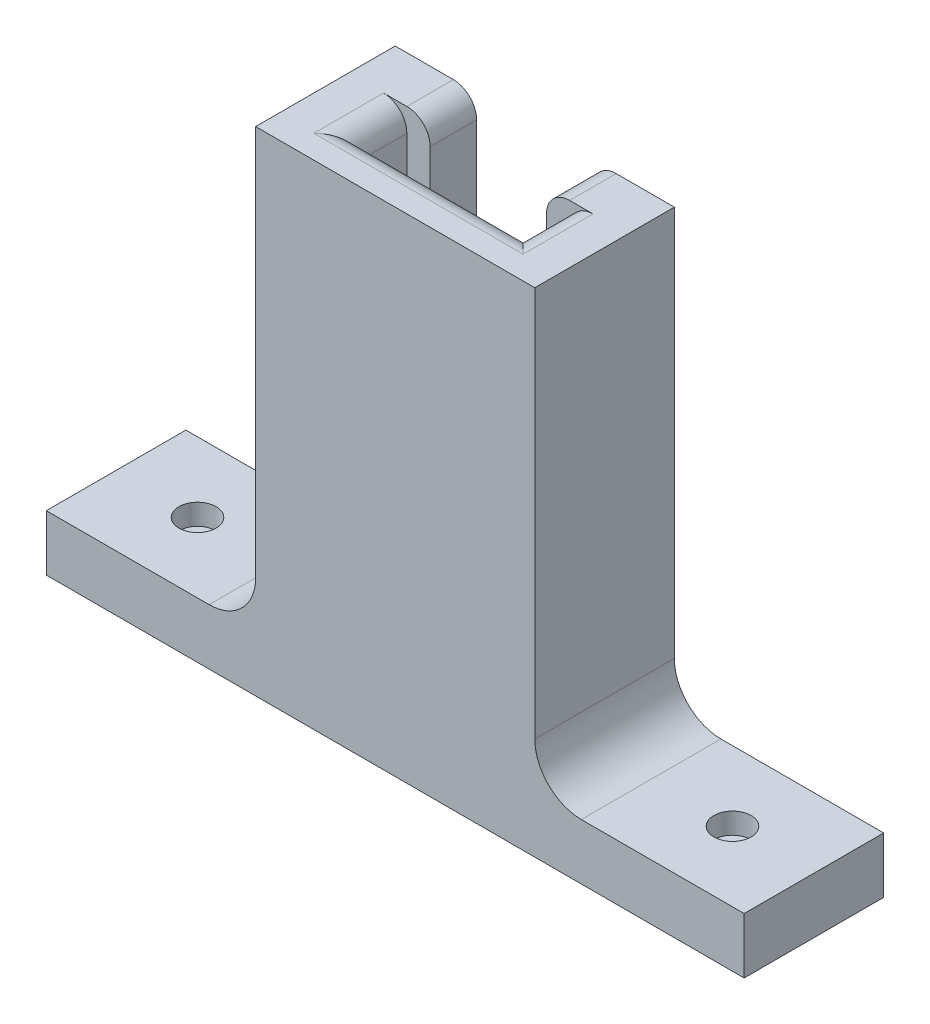
from build123d import *

# Parameters (mm, degrees)
SKETCH1_W           = 60
SKETCH1_H           = 100
SKETCH1_W_2         = 150
SKETCH1_H_2         = 12
BOSS_EXTRUDE1_DEPTH = 30
FILLET1_R           = 10
SKETCH2_W           = 25
SKETCH2_H           = 10
SKETCH2_H_2         = 5
CUT_EXTRUDE1_DEPTH  = 222
FILLET2_R           = 5
SKETCH3_R           = 2
CUT_EXTRUDE2_DEPTH  = 51
SKETCH4_R           = 4
CUT_EXTRUDE3_DEPTH  = 4.5


with BuildPart() as part:
    # Sketch1 → Boss-Extrude1 (new body)
    with BuildSketch(Plane.XY):
        Rectangle(SKETCH1_W, SKETCH1_H)
        with Locations((0, -50)):
            Rectangle(SKETCH1_W_2, SKETCH1_H_2)
    extrude(amount=BOSS_EXTRUDE1_DEPTH)

    # Fillet1
    fillet1_edges = [part.edges().sort_by_distance(p)[0] for p in [
        (-30, -44, 15),
        (30, -44, 15),
    ]]
    fillet(fillet1_edges, radius=FILLET1_R)

    # Sketch2 → Cut-Extrude1 (cut)
    with BuildSketch(Plane(origin=(0, 50, 0), x_dir=(1, 0, 0), z_dir=(0, 1, 0))):
        with Locations((0, -5)):
            Rectangle(SKETCH2_W, SKETCH2_H)
        with Locations((0, -12.5)):
            Rectangle(SKETCH2_W, SKETCH2_H_2)
        Polygon((17.5, -10), (12.5, -10), (12.5, -15), (-12.5, -15), (-12.5, -10), (-17.5, -10), (-17.5, -20), (17.5, -20), align=None)
    extrude(amount=-CUT_EXTRUDE1_DEPTH, mode=Mode.SUBTRACT)

    # Fillet2
    fillet2_edges = [part.edges().sort_by_distance(p)[0] for p in [
        (12.5, 50, 5),
        (-12.5, 50, 5),
        (0, 50, 20),
        (-17.5, 50, 15),
        (17.5, 50, 15),
    ]]
    fillet(fillet2_edges, radius=FILLET2_R)

    # Sketch3 → Cut-Extrude2 (cut)
    with BuildSketch(Plane(origin=(0, -44, 0), x_dir=(1, 0, 0), z_dir=(0, 1, 0))):
        with Locations(Location((-57.5, -15, 0), (0, 0, 270))):
            Circle(SKETCH3_R)
    cut_extrude2 = extrude(amount=-CUT_EXTRUDE2_DEPTH, mode=Mode.SUBTRACT)

    # Sketch4 → Cut-Extrude3 (cut)
    with BuildSketch(Plane(origin=(0, -44, 0), x_dir=(1, 0, 0), z_dir=(0, 1, 0))):
        with Locations(Location((-57.5, -15, 0), (0, 0, 270))):
            Circle(SKETCH4_R)
    cut_extrude3 = extrude(amount=-CUT_EXTRUDE3_DEPTH, mode=Mode.SUBTRACT)

    # Mirror1: Cut-Extrude2, Cut-Extrude3 across plane
    add(cut_extrude2.mirror(Plane(origin=(0, 0, 0), x_dir=(0, 0, 1), z_dir=(1, 0, 0))), mode=Mode.SUBTRACT)
    add(cut_extrude3.mirror(Plane(origin=(0, 0, 0), x_dir=(0, 0, 1), z_dir=(1, 0, 0))), mode=Mode.SUBTRACT)


solid = part.part
